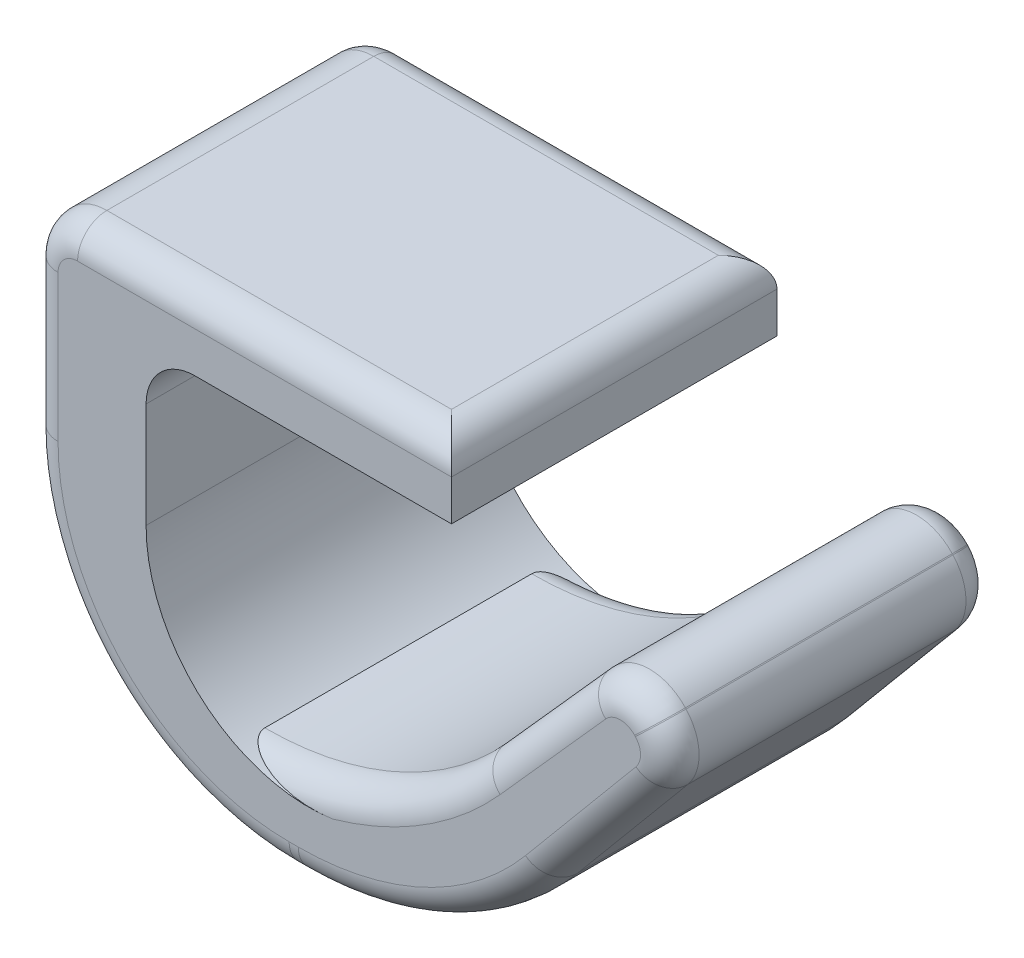
from build123d import *

# Parameters (mm, degrees)
SALIENTE_EXTRUIR1_DEPTH = 10
REDONDEO8_R             = 0.9


with BuildPart() as part:
    # Croquis2 → Saliente-Extruir1 (new body)
    with BuildSketch(Plane.XY):
        with BuildLine():
            Line((-5.744063225, 0), (5.744063225, 0))
            Line((5.744063225, 0), (5.744063225, -2.147495728))
            Line((5.744063225, -2.147495728), (-2.139285526, -2.147495728))
            ThreePointArc((-2.139285526, -2.147495728), (-3.199945698, -2.586835556), (-3.639285526, -3.647495728))
            Line((-3.639285526, -3.647495728), (-3.639285526, -6.880160463))
            ThreePointArc((-3.639285526, -6.880160463), (-2.897621881, -9.500574837), (-0.892656931, -11.34360278))
            ThreePointArc((-0.892656931, -11.34360278), (3.193809946, -10.470529341), (6.566719686, -8.003760473))
            Line((6.566719686, -8.003760473), (9.81244552, -4.368547538))
            ThreePointArc((9.81244552, -4.368547538), (10.916709754, -3.867642659), (12.03054225, -4.346894543))
            Line((12.03054225, -4.346894543), (12.051695209, -4.369674653))
            ThreePointArc((12.051695209, -4.369674653), (12.451992737, -5.351153846), (12.103519704, -6.352206325))
            Line((12.103519704, -6.352206325), (8.710612857, -10.412366821))
            ThreePointArc((8.710612857, -10.412366821), (5.272528505, -13.058798712), (1.037181306, -14))
            Line((1.037181306, -14), (0.755936775, -14))
            ThreePointArc((0.755936775, -14), (-4.900917475, -11.656854249), (-7.244063225, -6))
            Line((-7.244063225, -6), (-7.244063225, -1.5))
            ThreePointArc((-7.244063225, -1.5), (-6.804723397, -0.439339828), (-5.744063225, 0))
        make_face()
    extrude(amount=SALIENTE_EXTRUIR1_DEPTH)

    # Redondeo8
    redondeo8_edges = [part.edges().sort_by_distance(p)[0] for p in [
        (-6.804723397, -0.439339828, 10),
        (-7.244063225, -3.75, 10),
        (3.193809946, -10.470529341, 0),
        (8.189582603, -6.186154005, 0),
        (10.916709754, -3.867642659, 0),
        (12.041118729, -4.358284598, 0),
        (12.451992737, -5.351153846, 0),
        (10.40706628, -8.382286573, 0),
        (5.272528505, -13.058798712, 0),
        (-4.900917475, -11.656854249, 10),
        (0.89655904, -14, 0),
        (-4.900917475, -11.656854249, 0),
        (-7.244063225, -3.75, 0),
        (-6.804723397, -0.439339828, 0),
        (0, 0, 0),
        (0.89655904, -14, 10),
        (5.272528505, -13.058798712, 10),
        (5.744063225, 0, 5),
        (10.40706628, -8.382286573, 10),
        (12.451992737, -5.351153846, 10),
        (12.041118729, -4.358284598, 10),
        (10.916709754, -3.867642659, 10),
        (8.189582603, -6.186154005, 10),
        (3.193809946, -10.470529341, 10),
        (0, 0, 10),
    ]]
    fillet(redondeo8_edges, radius=REDONDEO8_R)


solid = part.part
